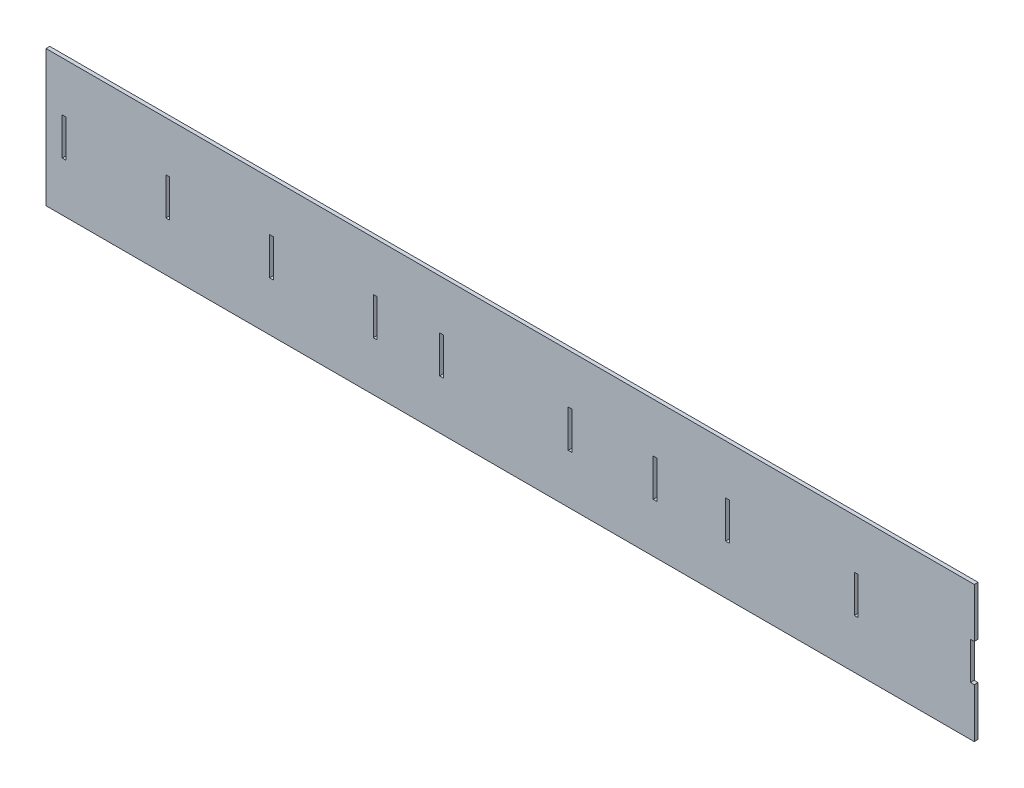
from build123d import *

# Parameters (mm, degrees)
SKETCH1_W           = 3
SKETCH1_H           = 30
BOSS_EXTRUDE1_DEPTH = 3


with BuildPart() as part:
    # Sketch1 → Boss-Extrude1 (new body)
    with BuildSketch(Plane.XY):
        Polygon((853.35106383, 109), (110.35106383, 109), (110.35106383, 0), (853.35106383, 0), (853.35106383, 39.5), (850.35106383, 39.5), (850.35106383, 69.5), (853.35106383, 69.5), align=None)
        with Locations((124.85106383, 54.5)):
            Rectangle(SKETCH1_W, SKETCH1_H, mode=Mode.SUBTRACT)
        with Locations((207.85106383, 54.5)):
            Rectangle(SKETCH1_W, SKETCH1_H, mode=Mode.SUBTRACT)
        with Locations((290.85106383, 54.5)):
            Rectangle(SKETCH1_W, SKETCH1_H, mode=Mode.SUBTRACT)
        with Locations((373.85106383, 54.5)):
            Rectangle(SKETCH1_W, SKETCH1_H, mode=Mode.SUBTRACT)
        with Locations((426.85106383, 54.5)):
            Rectangle(SKETCH1_W, SKETCH1_H, mode=Mode.SUBTRACT)
        with Locations((529.85106383, 54.5)):
            Rectangle(SKETCH1_W, SKETCH1_H, mode=Mode.SUBTRACT)
        with Locations((597.85106383, 54.5)):
            Rectangle(SKETCH1_W, SKETCH1_H, mode=Mode.SUBTRACT)
        with Locations((655.85106383, 54.5)):
            Rectangle(SKETCH1_W, SKETCH1_H, mode=Mode.SUBTRACT)
        with Locations((758.85106383, 54.5)):
            Rectangle(SKETCH1_W, SKETCH1_H, mode=Mode.SUBTRACT)
    extrude(amount=BOSS_EXTRUDE1_DEPTH)


solid = part.part
